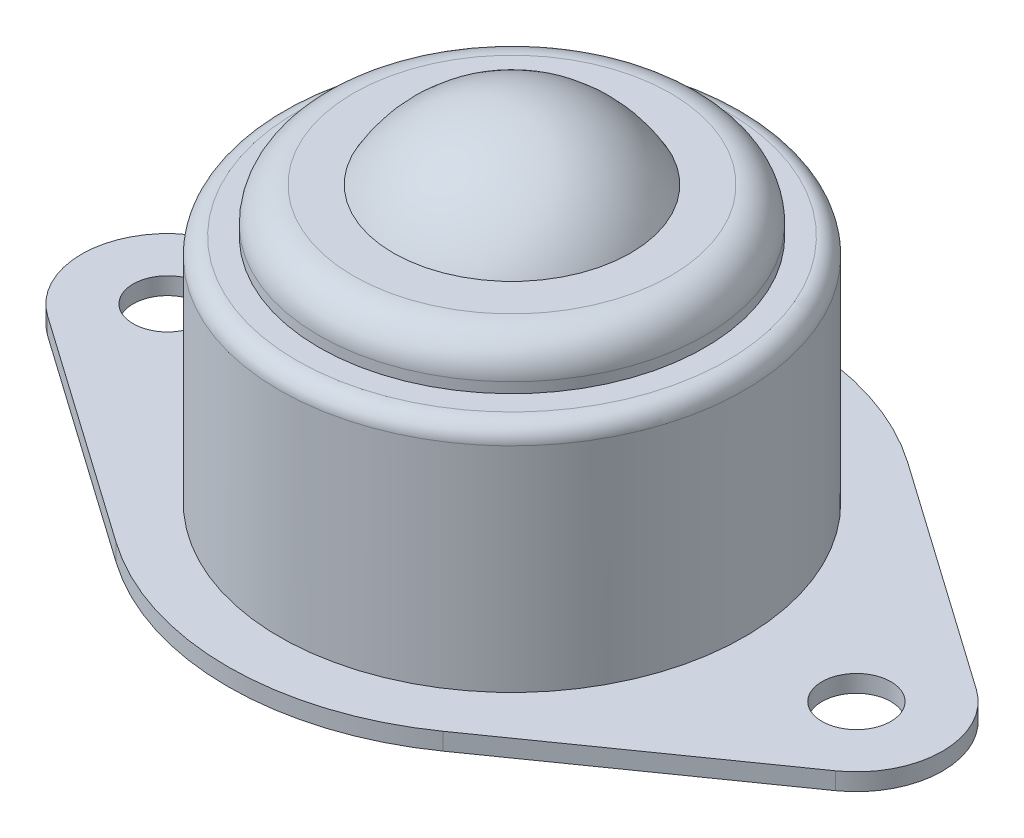
from build123d import *
from OCP.BRepFilletAPI import BRepFilletAPI_MakeFillet

# Parameters (mm, degrees)
SKETCH2_R           = 2
BOSS_EXTRUDE1_DEPTH = 1
FILLET1_R1          = 2
FILLET1_R2          = 1


with BuildPart() as part:
    # Sketch1 → Revolve1 (revolve)
    with BuildSketch(Plane.XY):
        with BuildLine():
            Line((-13.5, 0), (0, 0))
            Line((0, 0), (0, 4.125))
            ThreePointArc((0, 4.125), (-6.865049617, 8.078155637), (-6.892024376, 16))
            Line((-6.892024376, 16), (-11.2, 16))
            Line((-11.2, 16), (-11.2, 13.4))
            Line((-11.2, 13.4), (-13.5, 13.4))
            Line((-13.5, 13.4), (-13.5, 0))
        make_face()
    revolve(axis=Axis((0, 0, 0), (0, 1, 0)))

    # Sketch2 → Boss-Extrude1 (add)
    with BuildSketch(Plane.XZ):
        with BuildLine():
            Line((-22.875, 4.090767043), (-9.4875, 13.499531242))
            ThreePointArc((-9.4875, 13.499531242), (0, 16.5), (9.4875, 13.499531242))
            Line((9.4875, 13.499531242), (22.875, 4.090767043))
            ThreePointArc((22.875, 4.090767043), (25, 0), (22.875, -4.090767043))
            Line((22.875, -4.090767043), (9.4875, -13.499531242))
            ThreePointArc((9.4875, -13.499531242), (0, -16.5), (-9.4875, -13.499531242))
            Line((-9.4875, -13.499531242), (-22.875, -4.090767043))
            ThreePointArc((-22.875, -4.090767043), (-25, 0), (-22.875, 4.090767043))
        make_face()
        with Locations((-20, 0)):
            Circle(SKETCH2_R, mode=Mode.SUBTRACT)
        with Locations((20, 0)):
            Circle(SKETCH2_R, mode=Mode.SUBTRACT)
    extrude(amount=BOSS_EXTRUDE1_DEPTH)

    # Fillet1: one fillet with a radius per group of edges: ONE call of the kernel's fillet builder (fillet() takes one radius for all edges)
    fillet1_edges_1 = [part.edges().sort_by_distance(p)[0] for p in [
        (11.2, 16, 0),
    ]]
    fillet1_edges_2 = [part.edges().sort_by_distance(p)[0] for p in [
        (13.5, 13.4, 0),
    ]]
    fillet1 = BRepFilletAPI_MakeFillet(part.part.solid().wrapped)
    for e in fillet1_edges_1:
        fillet1.Add(FILLET1_R1, e.wrapped)
    for e in fillet1_edges_2:
        fillet1.Add(FILLET1_R2, e.wrapped)
    add(Compound.cast(fillet1.Shape()), mode=Mode.REPLACE)


with BuildPart() as body_2:
    # Sketch1<4> → Revolve2 (revolve)
    with BuildSketch(Plane.XY):
        with BuildLine():
            ThreePointArc((-6.892024376, 16), (-6.865049617, 8.078155637), (0, 4.125))
            Line((0, 4.125), (0, 20))
            ThreePointArc((0, 20), (-3.984344363, 18.927549617), (-6.892024376, 16))
        make_face()
    revolve(axis=Axis((0, 0, 0), (0, 1, 0)))


solid = Compound([part.part, body_2.part])
